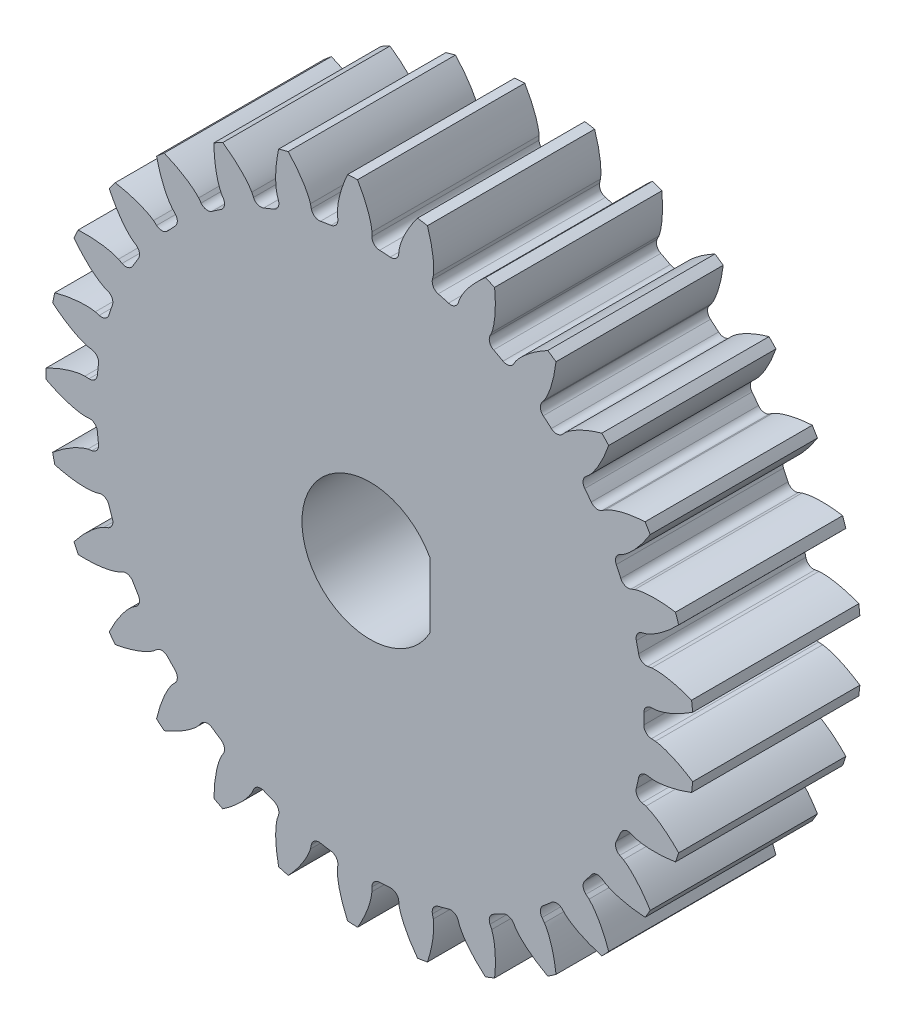
from build123d import *

# Parameters (mm, degrees)
BLANK_SKETCH_R    = 19.375
BLANK_DEPTH       = 10
TOOTH_SPACE_DEPTH = 30.168154724
TEETH_COUNT       = 29
BORE_DEPTH        = 30.158496743
BORE_DEPTH_BACK   = 30.158496743
BORE_SKETCH_R     = 4.075
D_FLAT_DEPTH      = 10


with BuildPart() as part:
    # Blank Sketch → Blank (new body)
    with BuildSketch(Plane.XY):
        Circle(BLANK_SKETCH_R)
    extrude(amount=BLANK_DEPTH)

    # Tooth Space Sketch → Tooth Space (cut, symmetric)
    with BuildSketch(Plane.XY):
        with BuildLine():
            Line((17.068054134, 0.814975045), (16.824135599, 0.803328286))
            ThreePointArc((16.824135599, 0.803328286), (16.499815882, 0.653266308), (16.371880835, 0.319598061))
            ThreePointArc((16.371880835, 0.319598061), (16.375, 0), (16.371880835, -0.319598061))
            ThreePointArc((16.371880835, -0.319598061), (16.499815882, -0.653266308), (16.824135599, -0.803328286))
            Line((16.824135599, -0.803328286), (17.068054134, -0.814975045))
            add(Edge.make_bspline(
                [(17.068054134, -0.814975045), (17.080639349, -0.816599716), (17.109387567, -0.820789164), (17.172178427, -0.830913745), (17.243306914, -0.845777886), (17.343167089, -0.868510317), (17.444836796, -0.896074329), (17.560885308, -0.930423819), (17.675279089, -0.968358235), (17.790689112, -1.009490191), (17.903896618, -1.053039999), (18.031315546, -1.105152258), (18.184701928, -1.172166321), (18.364436509, -1.257042968), (18.567385877, -1.360659849), (18.781420119, -1.479298365), (18.989524659, -1.60233286), (19.197553603, -1.734421666), (19.396273497, -1.866902742), (19.60078772, -2.012897299), (19.786432134, -2.14999124), (19.993860231, -2.314290896), (20.156000694, -2.445447553), (20.326991666, -2.593435931), (20.406748509, -2.663741602), (20.447478912, -2.700227983)],
                knots=[0.011934507, 0.011934507, 0.011934507, 0.011934507, 0.011934507, 0.024895003, 0.042157218, 0.060774038, 0.086082242, 0.114007164, 0.141932051, 0.169856948, 0.197781854, 0.225706783, 0.253631828, 0.295826813, 0.351676579, 0.407526489, 0.463376518, 0.519226321, 0.575076233, 0.630926156, 0.686776057, 0.74262603, 0.798475955, 0.854325796, 0.910175869, 0.910175869, 0.910175869, 0.910175869, 0.910175869], degree=4))
            Line((20.447478912, -2.700227983), (20.447478912, 2.700227983))
            add(Edge.make_bspline(
                [(17.068054134, 0.814975045), (17.080639349, 0.816599716), (17.109387567, 0.820789164), (17.172178427, 0.830913745), (17.243306914, 0.845777886), (17.343167089, 0.868510317), (17.444836796, 0.896074329), (17.560885308, 0.930423819), (17.675279089, 0.968358235), (17.790689112, 1.009490191), (17.903896618, 1.053039999), (18.031315546, 1.105152258), (18.184701928, 1.172166321), (18.364436509, 1.257042968), (18.567385877, 1.360659849), (18.781420119, 1.479298365), (18.989524659, 1.60233286), (19.197553603, 1.734421666), (19.396273497, 1.866902742), (19.60078772, 2.012897299), (19.786432134, 2.14999124), (19.993860231, 2.314290896), (20.156000694, 2.445447553), (20.326991666, 2.593435931), (20.406748509, 2.663741602), (20.447478912, 2.700227983)],
                knots=[0.011934507, 0.011934507, 0.011934507, 0.011934507, 0.011934507, 0.024895003, 0.042157218, 0.060774038, 0.086082242, 0.114007164, 0.141932051, 0.169856948, 0.197781854, 0.225706783, 0.253631828, 0.295826813, 0.351676579, 0.407526489, 0.463376518, 0.519226321, 0.575076233, 0.630926156, 0.686776057, 0.74262603, 0.798475955, 0.854325796, 0.910175869, 0.910175869, 0.910175869, 0.910175869, 0.910175869], degree=4))
        make_face()
    tooth_space = extrude(amount=TOOTH_SPACE_DEPTH, both=True, mode=Mode.SUBTRACT)

    # Teeth: Tooth Space ×29 about axis
    teeth_axis = Axis((0, 0, -0.50007105), (0, 0, 1))
    for i in range(1, TEETH_COUNT):
        add(tooth_space.rotate(teeth_axis, i * 360 / TEETH_COUNT), mode=Mode.SUBTRACT)

    # Bore Sketch → Bore (cut, two sides: drawn at the far end of the back side and taken through both)
    with BuildSketch(Plane.XY.offset(-BORE_DEPTH_BACK)):
        Circle(BORE_SKETCH_R)
    extrude(amount=BORE_DEPTH + BORE_DEPTH_BACK, mode=Mode.SUBTRACT)

    # D-Flat Sketch → D-Flat (add)
    with BuildSketch(Plane.XY):
        with BuildLine():
            Line((3.575, -2.389429848), (3.575, 2.389429848))
            ThreePointArc((3.575, 2.389429848), (4.3, 0), (3.575, -2.389429848))
        make_face()
    extrude(amount=D_FLAT_DEPTH)


solid = part.part
